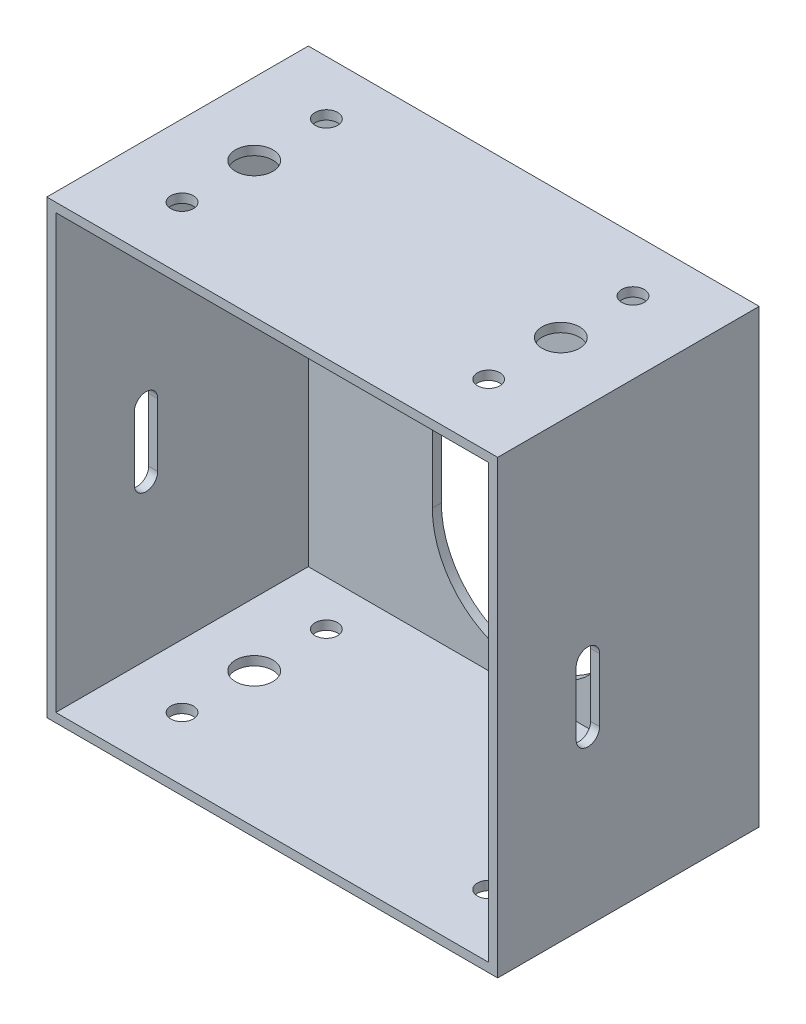
from build123d import *

# Parameters (mm, degrees)
SKETCH1_W               = 100
SKETCH1_H               = 100
SKETCH1_W_2             = 96
SKETCH1_H_2             = 96
EXTRUDE_THIN1_DEPTH     = 29
SKETCH2_W               = 100
SKETCH2_H               = 100
BOSS_EXTRUDE1_DEPTH     = 2
CUT_EXTRUDE1_REACH      = 92.2
CUT_EXTRUDE2_DEPTH      = 160
CUT_EXTRUDE3_DEPTH      = 160
CHAMFER1_SIZE           = 1
CUT_EXTRUDE4_DEPTH      = 116.503246708
CUT_EXTRUDE4_DEPTH_BACK = 116.503246708
SKETCH7_R               = 4.15
SKETCH8_R               = 2.5
CUT_EXTRUDE5_DEPTH      = 177


with BuildPart() as part:
    # Sketch1 → Extrude-Thin1 (new, symmetric)
    with BuildSketch(Plane.XY):
        Rectangle(SKETCH1_W, SKETCH1_H)
        Rectangle(SKETCH1_W_2, SKETCH1_H_2, mode=Mode.SUBTRACT)
    extrude(amount=EXTRUDE_THIN1_DEPTH, both=True)

    # Sketch2 → Boss-Extrude1 (add)
    with BuildSketch(Plane(origin=(0, 0, -29), x_dir=(-1, 0, 0), z_dir=(0, 0, -1))):
        Rectangle(SKETCH2_W, SKETCH2_H)
    extrude(amount=-BOSS_EXTRUDE1_DEPTH)

    # Sketch3 → Cut-Extrude1 (cut, up to next)
    with BuildSketch(Plane.XY.offset(-27), mode=Mode.PRIVATE) as cut_extrude1_sk1:
        with BuildLine():
            Line((-20.5, -23), (-20.5, 10))
            Line((-20.5, 10), (20.5, 10))
            Line((20.5, 10), (20.5, -23))
            ThreePointArc((20.5, -23), (0, -43.5), (-20.5, -23))
        make_face()
    cut_extrude1_tool1 = extrude(cut_extrude1_sk1.sketch, amount=-CUT_EXTRUDE1_REACH, mode=Mode.PRIVATE) & part.part
    add(cut_extrude1_tool1.solids().sort_by_distance((0, -14.763519, -27))[0], mode=Mode.SUBTRACT)

    # Sketch4 → Cut-Extrude2 (cut)
    with BuildSketch(Plane.ZY.offset(50)):
        with BuildLine():
            Line((11.6, 1), (11.6, -13))
            ThreePointArc((11.6, -13), (9, -15.6), (6.4, -13))
            Line((6.4, -13), (6.4, 1))
            ThreePointArc((6.4, 1), (9, 3.6), (11.6, 1))
        make_face()
    extrude(amount=-CUT_EXTRUDE2_DEPTH, mode=Mode.SUBTRACT)

    # Sketch6 → Cut-Extrude3 (cut)
    with BuildSketch(Plane(origin=(0, 0, -29), x_dir=(-1, 0, 0), z_dir=(0, 0, -1))):
        with BuildLine():
            Line((-2.6, 10), (-2.6, 30))
            ThreePointArc((-2.6, 30), (0, 32.6), (2.6, 30))
            Line((2.6, 30), (2.6, 10))
            ThreePointArc((2.6, 10), (0, 7.4), (-2.6, 10))
        make_face()
    extrude(amount=-CUT_EXTRUDE3_DEPTH, mode=Mode.SUBTRACT)

    # Chamfer1
    chamfer1_edges = [part.edges().sort_by_distance(p)[0] for p in [
        (-2.6, 10, -28),
        (2.6, 10, -28),
    ]]
    chamfer(chamfer1_edges, length=CHAMFER1_SIZE)

    # Sketch7 → Cut-Extrude4 (cut, two sides: drawn at the far end of the back side and taken through both)
    with BuildSketch(Plane(origin=(0, 50, 0), x_dir=(1, 0, 0), z_dir=(0, 1, 0)).offset(-CUT_EXTRUDE4_DEPTH_BACK)):
        with Locations(Location((-34, 1, 0), (0, 0, 270))):
            Circle(SKETCH7_R)
        with Locations(Location((34, 1, 0), (0, 0, 270))):
            Circle(SKETCH7_R)
    extrude(amount=CUT_EXTRUDE4_DEPTH + CUT_EXTRUDE4_DEPTH_BACK, mode=Mode.SUBTRACT)

    # Sketch8 → Cut-Extrude5 (cut)
    with BuildSketch(Plane(origin=(0, 50, 0), x_dir=(1, 0, 0), z_dir=(0, 1, 0))):
        with Locations(Location((-34, 17, 0), (0, 0, 270))):
            Circle(SKETCH8_R)
        with Locations(Location((-34, -15, 0), (0, 0, 270))):
            Circle(SKETCH8_R)
        with Locations(Location((34, 17, 0), (0, 0, 270))):
            Circle(SKETCH8_R)
        with Locations(Location((34, -15, 0), (0, 0, 270))):
            Circle(SKETCH8_R)
    extrude(amount=-CUT_EXTRUDE5_DEPTH, mode=Mode.SUBTRACT)


solid = part.part
